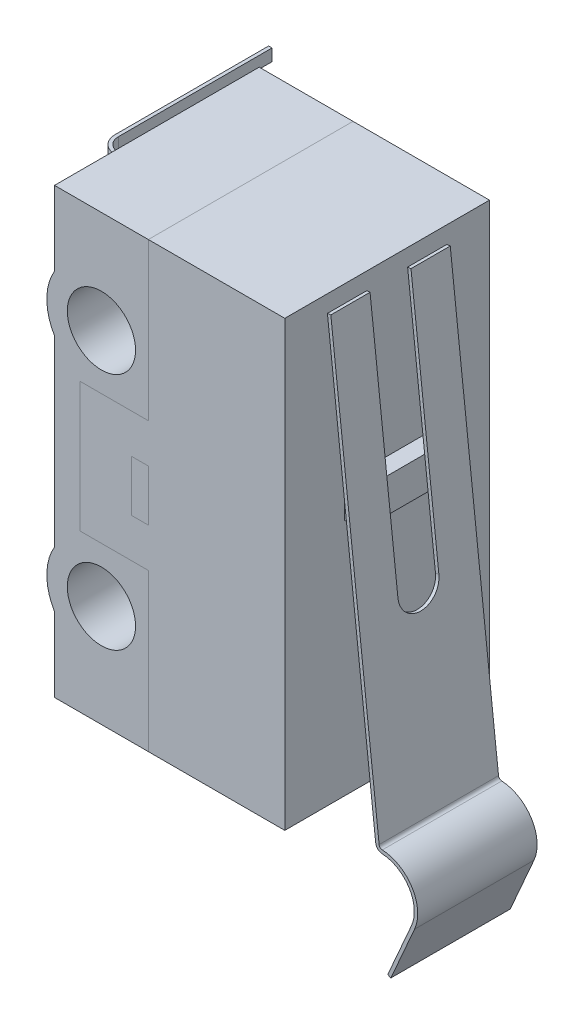
from build123d import *

# Parameters (mm, degrees)
ESQUISSE1_W                    = 0.5
ESQUISSE1_H                    = 1.5
BOSS_EXTRU_1_DEPTH             = 3
ESQUISSE2_R                    = 1
BOSS_EXTRU_2_DEPTH             = 6
ESQUISSE2_W                    = 0.5
ESQUISSE2_H                    = 1.5
BOSS_EXTRU_2_2_DEPTH           = 6
ESQUISSE3_W                    = 0.5
ESQUISSE3_H                    = 1
BOSS_EXTRU_3_DEPTH             = 1.25
BOSS_EXTRU_4_DEPTH             = 1.75
ENL_V_MAT_EXTRU_1_DEPTH        = 0.1
BOSS_EXTRU_5_DEPTH             = 0.175
R_P_TITION_LIN_AIRE1_COUNT     = 2
R_P_TITION_LIN_AIRE1_PITCH     = 5
R_P_TITION_LIN_AIRE1_COL_COUNT = 2
R_P_TITION_LIN_AIRE1_COL_PITCH = 5


with BuildPart() as part:
    # Esquisse1 → Boss.-Extru.1 (new, symmetric)
    with BuildSketch(Plane.XY):
        Polygon((-4, -1.9), (-4, -6.5), (0, -6.5), (0, 6.5), (-4, 6.5), (-4, 1.9), (-6, 1.9), (-6, -1.9), align=None)
        with Locations((-4.25, 0)):
            Rectangle(ESQUISSE1_W, ESQUISSE1_H, mode=Mode.SUBTRACT)
    extrude(amount=BOSS_EXTRU_1_DEPTH, both=True)


with BuildPart() as body_2:
    # Esquisse2 → Boss.-Extru.2 (new body)
    with BuildSketch(Plane.XY.offset(3)):
        with BuildLine():
            Line((-4, 6.5), (-6.75, 6.5))
            Line((-6.75, 6.5), (-6.75, 4.318153409))
            ThreePointArc((-6.75, 4.318153409), (-6.975, 3.5), (-6.75, 2.681846591))
            Line((-6.75, 2.681846591), (-6.75, -2.681846591))
            ThreePointArc((-6.75, -2.681846591), (-6.975, -3.5), (-6.75, -4.318153409))
            Line((-6.75, -4.318153409), (-6.75, -6.5))
            Line((-6.75, -6.5), (-4, -6.5))
            Line((-4, -6.5), (-4, -1.9))
            Line((-4, -1.9), (-6, -1.9))
            Line((-6, -1.9), (-6, 1.9))
            Line((-6, 1.9), (-4, 1.9))
            Line((-4, 1.9), (-4, 6.5))
        make_face()
        with Locations((-5.375, 3.5)):
            Circle(ESQUISSE2_R, mode=Mode.SUBTRACT)
        with Locations((-5.375, -3.5)):
            Circle(ESQUISSE2_R, mode=Mode.SUBTRACT)
    extrude(amount=-BOSS_EXTRU_2_DEPTH)


with BuildPart() as body_3:
    # Esquisse2 → Boss.-Extru.2 2 (new body)
    with BuildSketch(Plane.XY.offset(3)):
        with Locations((-4.25, 0)):
            Rectangle(ESQUISSE2_W, ESQUISSE2_H)
    extrude(amount=-BOSS_EXTRU_2_2_DEPTH)


with BuildPart() as body_4:
    # Esquisse3 → Boss.-Extru.3 (new, symmetric)
    with BuildSketch(Plane.XY):
        with Locations((0.25, 1)):
            Rectangle(ESQUISSE3_W, ESQUISSE3_H)
    extrude(amount=BOSS_EXTRU_3_DEPTH, both=True)


with BuildPart() as body_5:
    # Esquisse4 → Boss.-Extru.4 (new, symmetric)
    with BuildSketch(Plane.XY):
        with BuildLine():
            Line((0, 6), (1.415377021, -6.738393192))
            ThreePointArc((1.415377021, -6.738393192), (1.476592169, -6.861485419), (1.602801701, -6.915984453))
            ThreePointArc((1.602801701, -6.915984453), (2.398287719, -7.391231624), (2.461985691, -8.315677646))
            Line((2.461985691, -8.315677646), (1.766904417, -9.902139755))
            Line((1.766904417, -9.902139755), (1.85849885, -9.942270291))
            Line((1.85849885, -9.942270291), (2.553580123, -8.355808182))
            ThreePointArc((2.553580123, -8.355808182), (2.483512355, -7.338917558), (1.608477735, -6.81614567))
            ThreePointArc((1.608477735, -6.81614567), (1.545372968, -6.788896153), (1.514765395, -6.727350039))
            Line((1.514765395, -6.727350039), (0.099388373, 6.011043153))
            Line((0.099388373, 6.011043153), (0, 6))
        make_face()
    extrude(amount=BOSS_EXTRU_4_DEPTH, both=True)

    # Esquisse5 → Enlèv. mat.-Extru.1 (cut)
    with BuildSketch(Plane(origin=(0.757924959, 0.084213884, 0), x_dir=(0, 0, -1), z_dir=(0.9938837346736189, 0.11043152607484652, 0))):
        with BuildLine():
            Line((-0.6, 5.963302408), (-0.6, -1.436697592))
            ThreePointArc((-0.6, -1.436697592), (0, -2.036697592), (0.6, -1.436697592))
            Line((0.6, -1.436697592), (0.6, 5.963302408))
            Line((0.6, 5.963302408), (-0.6, 5.963302408))
        make_face()
    extrude(amount=-ENL_V_MAT_EXTRU_1_DEPTH, mode=Mode.SUBTRACT)


with BuildPart() as body_6:
    # Esquisse6 → Boss.-Extru.5 (new, symmetric)
    with BuildSketch(Plane(origin=(0, 0, 0), x_dir=(1, 0, 0), z_dir=(0, 1, 0))):
        with BuildLine():
            Line((-6.975, 0), (-7.975, 0))
            ThreePointArc((-7.975, 0), (-8.328553391, 0.146446609), (-8.475, 0.5))
            Line((-8.475, 0.5), (-8.475, 5))
            Line((-8.475, 5), (-8.375, 5))
            Line((-8.375, 5), (-8.375, 0.5))
            ThreePointArc((-8.375, 0.5), (-8.257842712, 0.217157288), (-7.975, 0.1))
            Line((-7.975, 0.1), (-6.975, 0.1))
            Line((-6.975, 0.1), (-6.75, 0.1))
            Line((-6.75, 0.1), (-6.75, 0))
            Line((-6.75, 0), (-6.975, 0))
        make_face()
    boss_extru_5 = extrude(amount=BOSS_EXTRU_5_DEPTH, both=True)


with BuildPart() as body_2_1:
    add(body_2.part)

    # Répétition linéaire1: Boss.-Extru.5 ×2
    with Locations(*[(0, i * R_P_TITION_LIN_AIRE1_PITCH, 0) for i in range(1, R_P_TITION_LIN_AIRE1_COUNT)]):
        add(boss_extru_5)


with BuildPart() as r_p_tition_lin_aire1_col_1:
    # Répétition linéaire1 col: Boss.-Extru.5 ×2
    with Locations(*[(0, -i * R_P_TITION_LIN_AIRE1_COL_PITCH, 0) for i in range(1, R_P_TITION_LIN_AIRE1_COL_COUNT)]):
        add(boss_extru_5)


with BuildPart() as body_2_2:
    add(body_2_1.part)

    # Répétition linéaire1 col united with wha: union body 6, Répétition linéaire1 col_1
    add(body_6.part)
    add(r_p_tition_lin_aire1_col_1.part)


solid = Compound([part.part, body_3.part, body_4.part, body_5.part, body_2_2.part])
